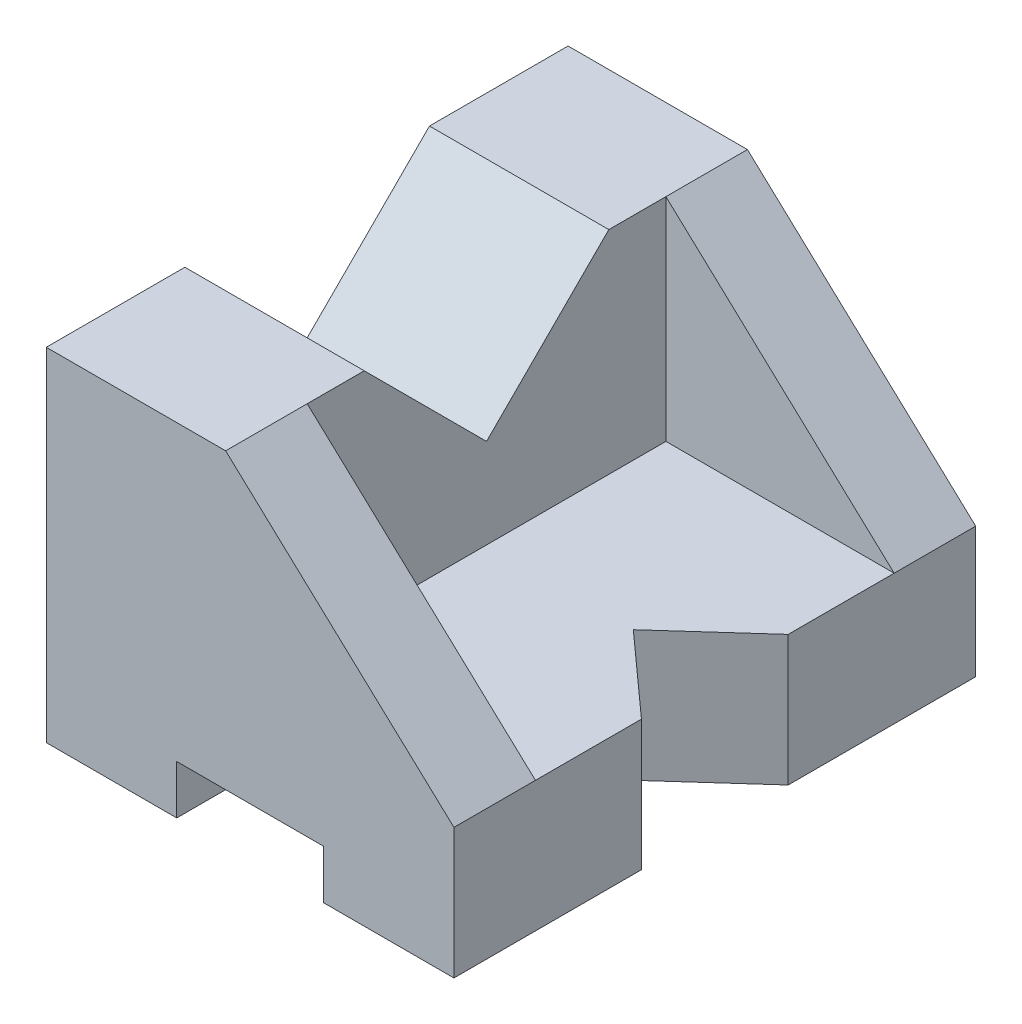
from build123d import *

# Parameters (mm, degrees)
BOSS_EXTRUDE2_DEPTH = 64
SKETCH3_W           = 28
SKETCH3_H           = 44
CUT_EXTRUDE3_DEPTH  = 26
CUT_EXTRUDE4_DEPTH  = 82.510735489
CUT_EXTRUDE6_DEPTH  = 86.276022421


with BuildPart() as part:
    # Sketch1 → Boss-Extrude2 (new body)
    with BuildSketch(Plane.XY):
        Polygon((0, 0), (0, 42), (22, 42), (50, 16), (50, 0), (34, 0), (34, 6), (16, 6), (16, 0), align=None)
    extrude(amount=-BOSS_EXTRUDE2_DEPTH)

    # Sketch3 → Cut-Extrude3 (cut)
    with BuildSketch(Plane(origin=(0, 42, 0), x_dir=(1, 0, 0), z_dir=(0, 1, 0))):
        with Locations((36, 32)):
            Rectangle(SKETCH3_W, SKETCH3_H)
    extrude(amount=-CUT_EXTRUDE3_DEPTH, mode=Mode.SUBTRACT)

    # Sketch5 → Cut-Extrude4 (cut, through all)
    with BuildSketch(Plane(origin=(22, 0, 0), x_dir=(0, 0, -1), z_dir=(1, 0, 0))):
        Polygon((32, 27), (47, 42), (17, 42), align=None)
    extrude(amount=-CUT_EXTRUDE4_DEPTH, mode=Mode.SUBTRACT)

    # Sketch7 → Cut-Extrude6 (cut, through all)
    with BuildSketch(Plane(origin=(0, 16, 0), x_dir=(1, 0, 0), z_dir=(0, 1, 0))):
        Polygon((40, 32), (50, 41), (50, 23), align=None)
    extrude(amount=-CUT_EXTRUDE6_DEPTH, mode=Mode.SUBTRACT)


solid = part.part
